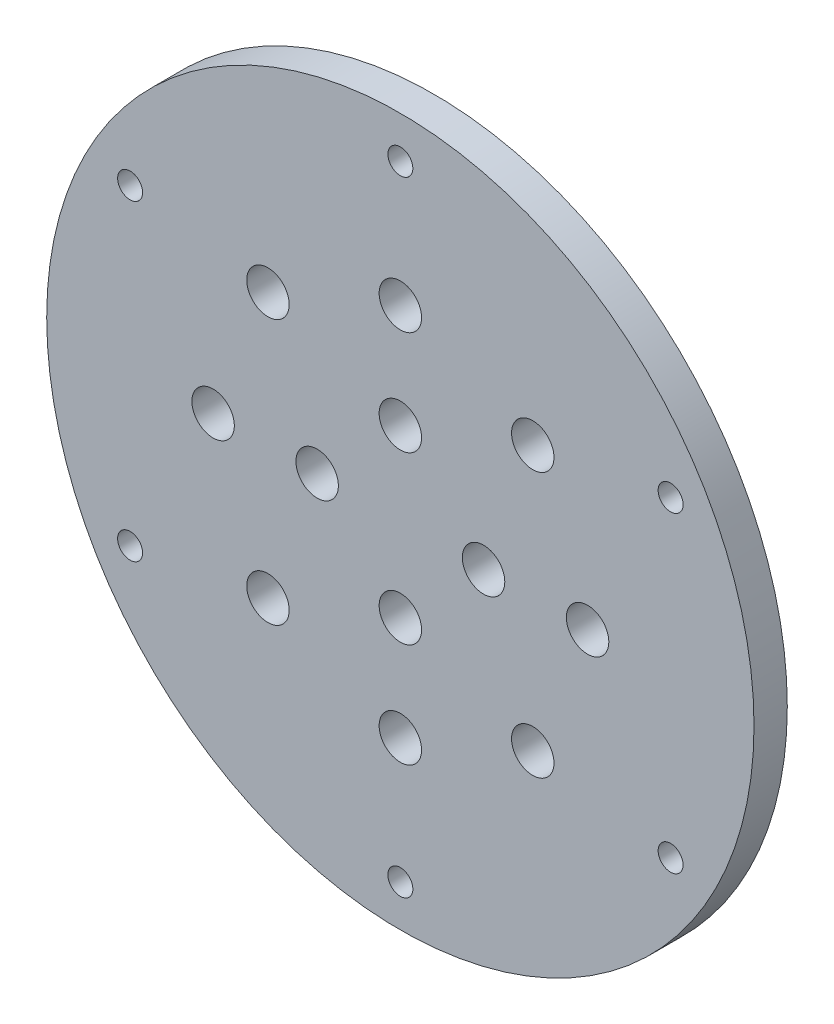
from build123d import *

# Parameters (mm, degrees)
SKETCH_1_R          = 85
SKETCH_1_R_2        = 3
EXTRUDE_1_DEPTH     = 8
SKETCH_2_R          = 5.1
CUT_EXTRUDE_1_DEPTH = 121.474063599


with BuildPart() as part:
    # 草图1 → 凸台-拉伸1 (new body)
    with BuildSketch(Plane.XY):
        Circle(SKETCH_1_R)
        with Locations((0, 75)):
            Circle(SKETCH_1_R_2, mode=Mode.SUBTRACT)
        with Locations((64.951905284, 37.5)):
            Circle(SKETCH_1_R_2, mode=Mode.SUBTRACT)
        with Locations((64.951905284, -37.5)):
            Circle(SKETCH_1_R_2, mode=Mode.SUBTRACT)
        with Locations((0, -75)):
            Circle(SKETCH_1_R_2, mode=Mode.SUBTRACT)
        with Locations((-64.951905284, -37.5)):
            Circle(SKETCH_1_R_2, mode=Mode.SUBTRACT)
        with Locations((-64.951905284, 37.5)):
            Circle(SKETCH_1_R_2, mode=Mode.SUBTRACT)
    extrude(amount=EXTRUDE_1_DEPTH)

    # 草图2 → 切除-拉伸1 (cut, through all)
    with BuildSketch(Plane.XY.offset(8)):
        with Locations((0, 45)):
            Circle(SKETCH_2_R)
        with Locations((31.819805153, 31.819805153)):
            Circle(SKETCH_2_R)
        with Locations((45, 0)):
            Circle(SKETCH_2_R)
        with Locations((31.819805153, -31.819805153)):
            Circle(SKETCH_2_R)
        with Locations((0, -45)):
            Circle(SKETCH_2_R)
        with Locations((-31.819805153, -31.819805153)):
            Circle(SKETCH_2_R)
        with Locations((-45, 0)):
            Circle(SKETCH_2_R)
        with Locations((-31.819805153, 31.819805153)):
            Circle(SKETCH_2_R)
        with Locations((0, 20)):
            Circle(SKETCH_2_R)
        with Locations((20, 0)):
            Circle(SKETCH_2_R)
        with Locations((0, -20)):
            Circle(SKETCH_2_R)
        with Locations((-20, 0)):
            Circle(SKETCH_2_R)
    extrude(amount=-CUT_EXTRUDE_1_DEPTH, mode=Mode.SUBTRACT)


solid = part.part
